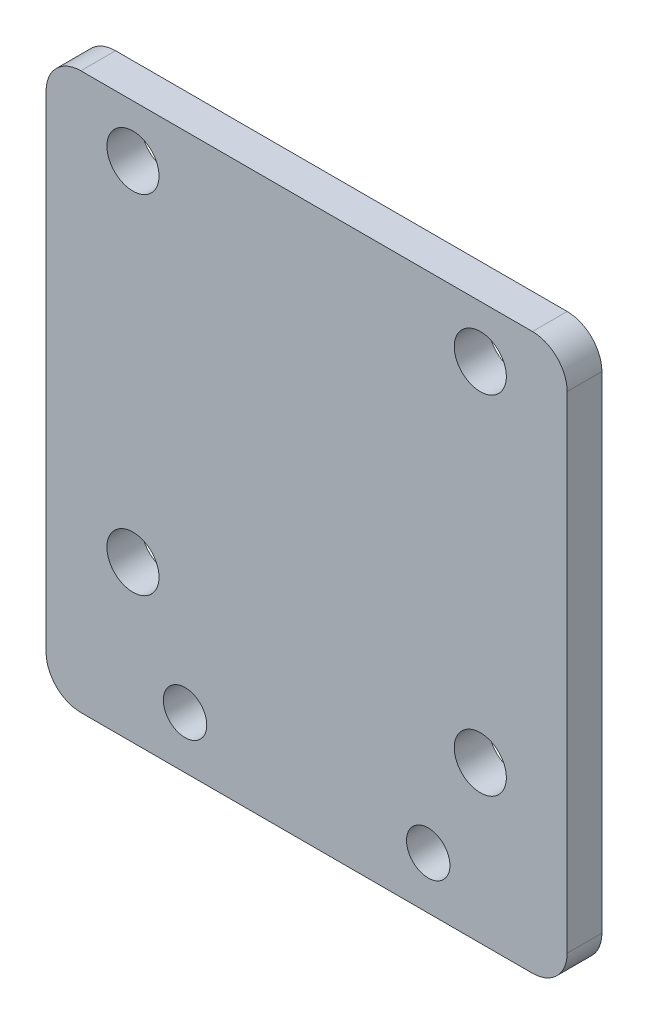
from build123d import *

# Parameters (mm, degrees)
SKETCH_1_W      = 30
SKETCH_1_H      = 32
SKETCH_1_R      = 1.25
SKETCH_1_R_2    = 1.5
EXTRUDE_1_DEPTH = 2
FILLET_1_R      = 2


with BuildPart() as part:
    # ｽｹｯﾁ1 → ﾎﾞｽ - 押し出し1 (new body)
    with BuildSketch(Plane.XY):
        Rectangle(SKETCH_1_W, SKETCH_1_H)
        with Locations((-7, -13)):
            Circle(SKETCH_1_R, mode=Mode.SUBTRACT)
        with Locations((7, -13)):
            Circle(SKETCH_1_R, mode=Mode.SUBTRACT)
        with Locations((-10, -7)):
            Circle(SKETCH_1_R_2, mode=Mode.SUBTRACT)
        with Locations((-10, 13)):
            Circle(SKETCH_1_R_2, mode=Mode.SUBTRACT)
        with Locations((10, 13)):
            Circle(SKETCH_1_R_2, mode=Mode.SUBTRACT)
        with Locations((10, -7)):
            Circle(SKETCH_1_R_2, mode=Mode.SUBTRACT)
    extrude(amount=EXTRUDE_1_DEPTH)

    # ﾌｨﾚｯﾄ1
    fillet_1_edges = [part.edges().sort_by_distance(p)[0] for p in [
        (15, -16, 1),
        (-15, -16, 1),
        (-15, 16, 1),
        (15, 16, 1),
    ]]
    fillet(fillet_1_edges, radius=FILLET_1_R)


solid = part.part
